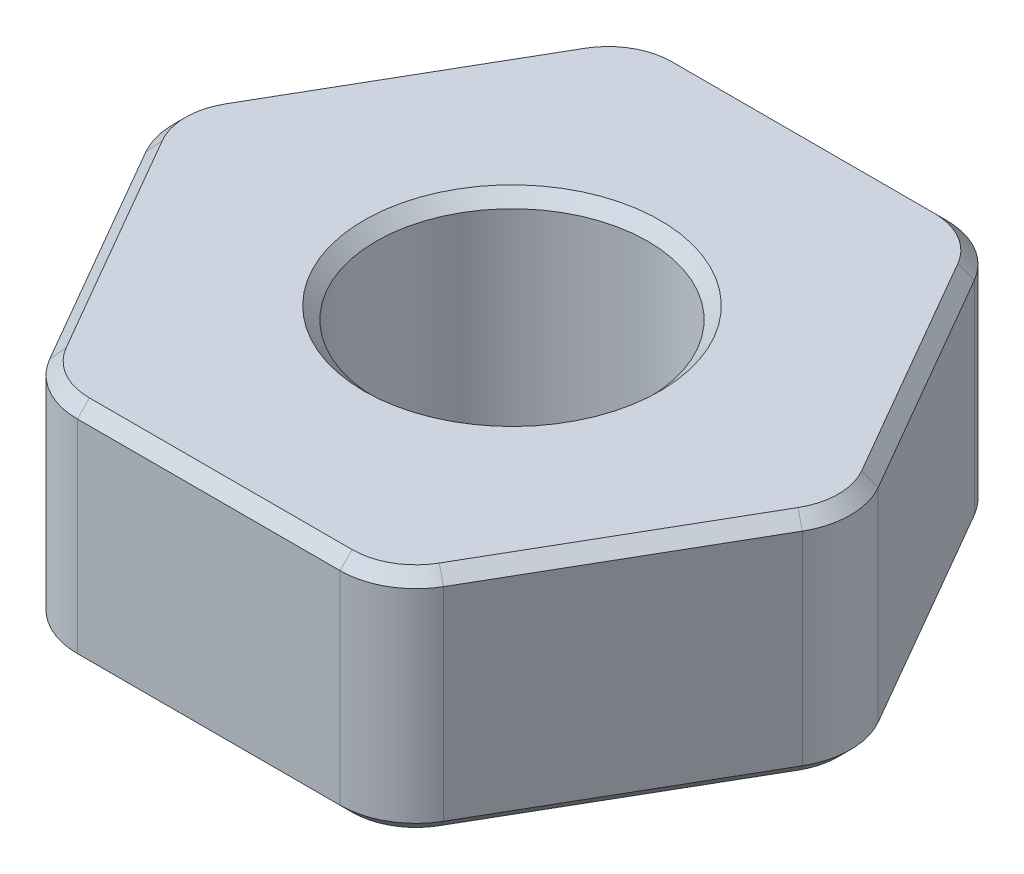
from build123d import *

# Parameters (mm, degrees)
SKETCH3_R           = 1.4224
BOSS_EXTRUDE1_DEPTH = 1.190625
FILLET1_R           = 0.79375
CHAMFER1_SIZE       = 0.127


with BuildPart() as part:
    # Sketch3 → Boss-Extrude1 (new, symmetric)
    with BuildSketch(Plane(origin=(0, 0, 0), x_dir=(1, 0, 0), z_dir=(0, 1, 0))):
        Polygon((1.833087105, 3.175), (-1.833087105, 3.175), (-3.666174209, 0), (-1.833087105, -3.175), (1.833087105, -3.175), (3.666174209, 0), align=None)
        with Locations(Location((0, 0, 0), (0, 0, 90))):
            Circle(SKETCH3_R, mode=Mode.SUBTRACT)
    extrude(amount=BOSS_EXTRUDE1_DEPTH, both=True)

    # Fillet1
    fillet1_edges = [part.edges().sort_by_distance(p)[0] for p in [
        (3.666174209, 0, 0),
        (1.833087105, 0, 3.175),
        (-1.833087105, 0, 3.175),
        (-3.666174209, 0, 0),
        (-1.833087105, 0, -3.175),
        (1.833087105, 0, -3.175),
    ]]
    fillet(fillet1_edges, radius=FILLET1_R)

    # Chamfer1
    chamfer1_edges = [part.edges().sort_by_distance(p)[0] for p in [
        (0, -1.190625, 1.4224),
        (0, 1.190625, 1.4224),
        (2.749630657, -1.190625, -1.5875),
        (2.749630657, 1.190625, -1.5875),
        (2.749630657, -1.190625, 1.5875),
        (0, -1.190625, 3.175),
        (-2.749630657, -1.190625, 1.5875),
        (-2.749630657, -1.190625, -1.5875),
        (0, -1.190625, -3.175),
        (-1.771690329, -1.190625, 3.068657664),
        (1.771690329, -1.190625, -3.068657664),
        (-1.771690329, -1.190625, -3.068657664),
        (-3.543380657, -1.190625, 0),
        (1.771690329, -1.190625, 3.068657664),
        (3.543380657, -1.190625, 0),
        (2.749630657, 1.190625, 1.5875),
        (0, 1.190625, -3.175),
        (-2.749630657, 1.190625, -1.5875),
        (-2.749630657, 1.190625, 1.5875),
        (0, 1.190625, 3.175),
        (-1.771690329, 1.190625, 3.068657664),
        (1.771690329, 1.190625, -3.068657664),
        (-1.771690329, 1.190625, -3.068657664),
        (-3.543380657, 1.190625, 0),
        (1.771690329, 1.190625, 3.068657664),
        (3.543380657, 1.190625, 0),
    ]]
    chamfer(chamfer1_edges, length=CHAMFER1_SIZE)


solid = part.part
